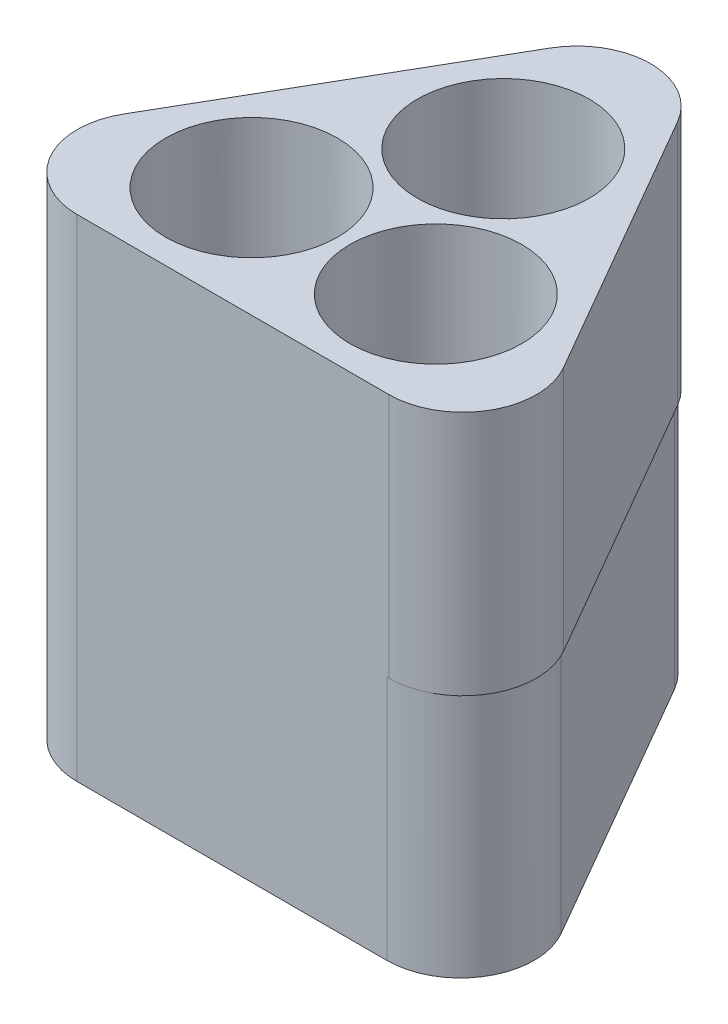
from build123d import *
from build123d.topology import SkipClean

# Parameters (mm, degrees)
SKETCH_1_R      = 3.5
EXTRUDE_1_DEPTH = 10
EXTRUDE_START   = 10
EXTRUDE_2_DEPTH = 10


with BuildPart() as part:
    # Эскиз1 → Бобышка-Вытянуть1 (new body)
    with BuildSketch(Plane(origin=(0, 0, 0), x_dir=(1, 0, 0), z_dir=(0, 1, 0))):
        with BuildLine():
            Line((5.196152423, 0), (17.897858345, 0))
            ThreePointArc((17.897858345, 0), (20.495934556, 1.5), (20.495934556, 4.5))
            Line((20.495934556, 4.5), (14.145081595, 15.5))
            ThreePointArc((14.145081595, 15.5), (11.547005384, 17), (8.948929172, 15.5))
            Line((8.948929172, 15.5), (2.598076211, 4.5))
            ThreePointArc((2.598076211, 4.5), (2.598076211, 1.5), (5.196152423, 0))
        make_face()
        with Locations(Location((15.299782134, 4.5, 0), (0, 0, 270))):
            Circle(SKETCH_1_R, mode=Mode.SUBTRACT)
        with Locations(Location((11.547005384, 11, 0), (0, 0, 270))):
            Circle(SKETCH_1_R, mode=Mode.SUBTRACT)
        with Locations(Location((7.794228634, 4.5, 0), (0, 0, 270))):
            Circle(SKETCH_1_R, mode=Mode.SUBTRACT)
    extrude(amount=EXTRUDE_1_DEPTH)

    # Эскиз4 → Бобышка-Вытянуть2 (add)
    with SkipClean():  # the faces are left unmerged after this step: merging them gives an invalid solid
        with BuildSketch(Plane(origin=(0, 0, 0), x_dir=(-1, 0, 0), z_dir=(0, -1, 0)).offset(EXTRUDE_START)):
            with BuildLine():
                Line((-5.196152423, 0), (-17.803847577, 0))
                ThreePointArc((-17.803847577, 0), (-20.401923789, 1.5), (-20.401923789, 4.5))
                Line((-20.401923789, 4.5), (-14.098076211, 15.418584287))
                ThreePointArc((-14.098076211, 15.418584287), (-11.5, 16.918584287), (-8.901923789, 15.418584287))
                Line((-8.901923789, 15.418584287), (-2.598076211, 4.5))
                ThreePointArc((-2.598076211, 4.5), (-2.598076211, 1.5), (-5.196152423, 0))
            make_face()
            with BuildLine():
                Line((-7.794228634, 1), (-15.299782134, 1))
                ThreePointArc((-15.299782134, 1), (-18.330871047, 2.75), (-18.330871047, 6.25))
                Line((-18.330871047, 6.25), (-14.578094297, 12.75))
                ThreePointArc((-14.578094297, 12.75), (-11.547005384, 14.5), (-8.515916471, 12.75))
                Line((-8.515916471, 12.75), (-4.763139721, 6.25))
                ThreePointArc((-4.763139721, 6.25), (-4.763139721, 2.75), (-7.794228634, 1))
            make_face(mode=Mode.SUBTRACT)
        extrude(amount=-EXTRUDE_2_DEPTH)


solid = part.part
